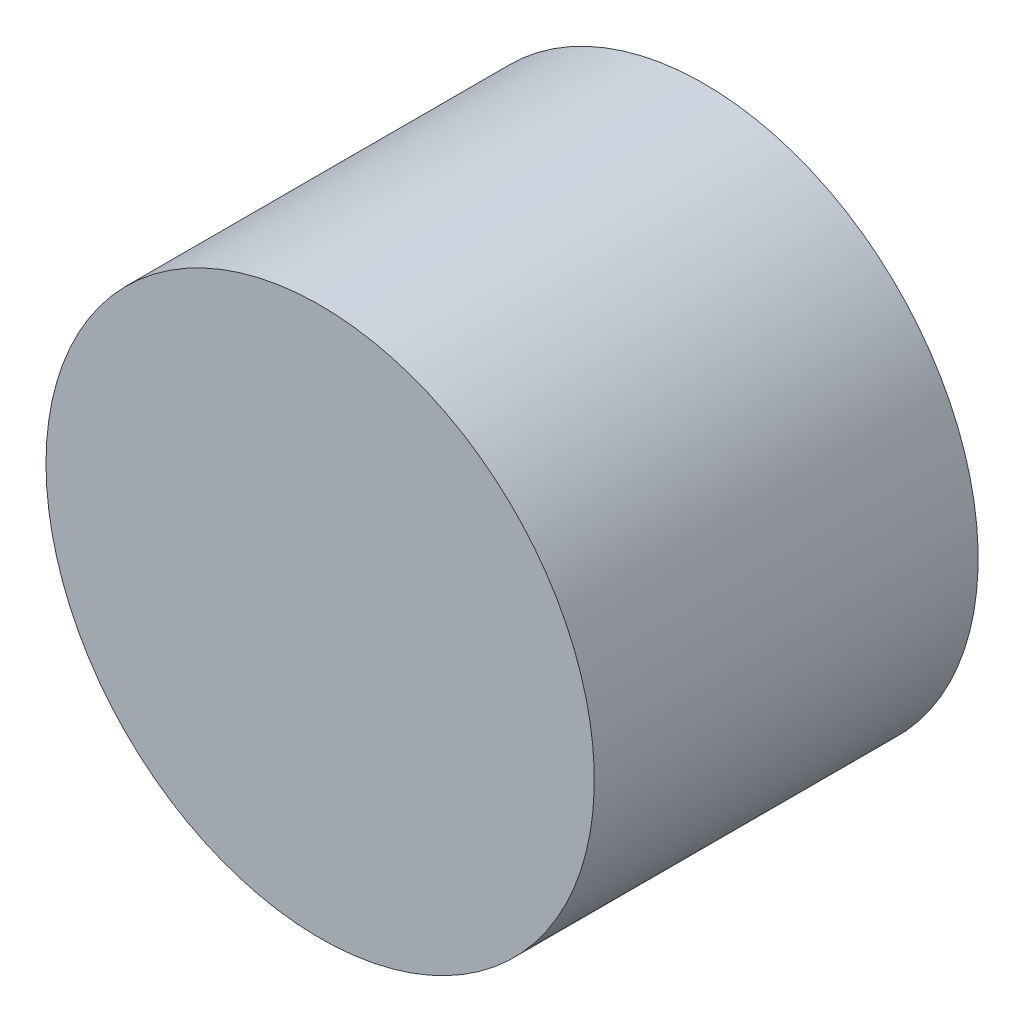
from build123d import *

# Parameters (mm, degrees)
CROQUIS1_R              = 15
SALIENTE_EXTRUIR1_DEPTH = 21
CROQUIS2_R              = 2
CORTAR_EXTRUIR1_DEPTH   = 10


with BuildPart() as part:
    # Croquis1 → Saliente-Extruir1 (new body)
    with BuildSketch(Plane.XY):
        with Locations(Location((0, 0, 0), (0, 0, 180))):
            Circle(CROQUIS1_R)
    extrude(amount=SALIENTE_EXTRUIR1_DEPTH)

    # Croquis2 → Cortar-Extruir1 (cut)
    with BuildSketch(Plane(origin=(0, 0, 0), x_dir=(-1, 0, 0), z_dir=(0, 0, -1))):
        Circle(CROQUIS2_R)
    extrude(amount=-CORTAR_EXTRUIR1_DEPTH, mode=Mode.SUBTRACT)


solid = part.part
